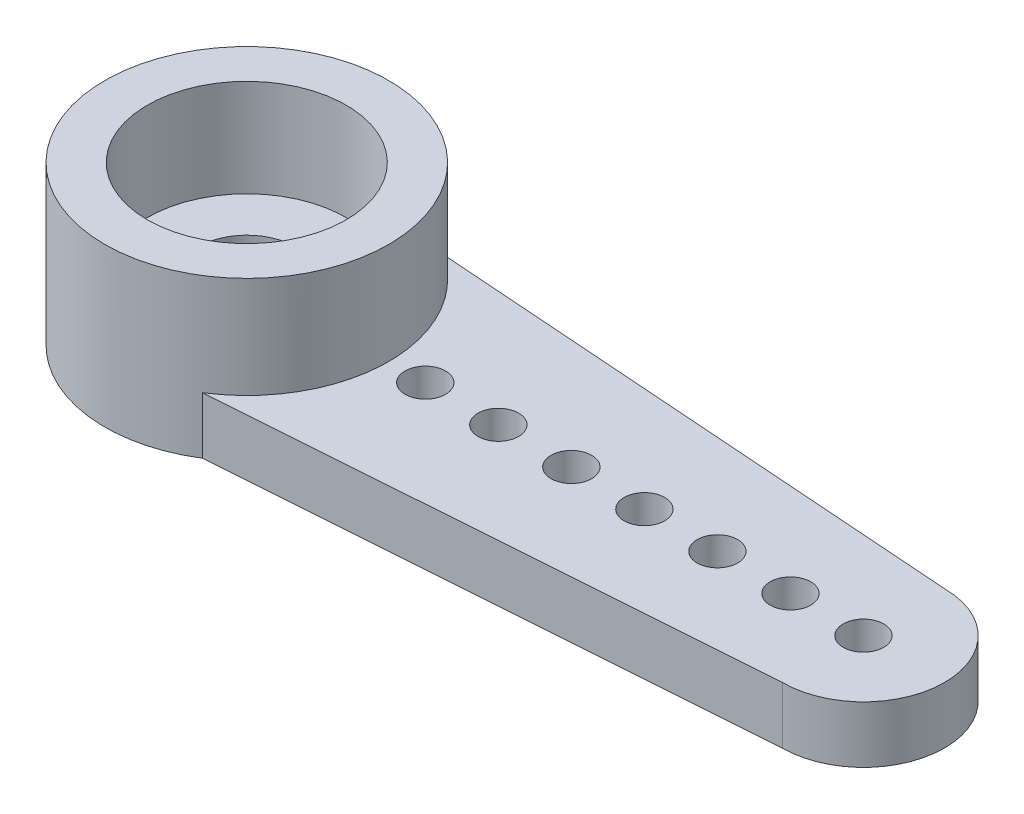
from build123d import *

# Parameters (mm, degrees)
SKETCH1_R           = 0.5
BOSS_EXTRUDE1_DEPTH = 1.4
SKETCH2_R           = 2.35
CUT_EXTRUDE1_DEPTH  = 1
SKETCH3_R           = 3.5
SKETCH3_R_2         = 2.45
BOSS_EXTRUDE2_DEPTH = 2.5
SKETCH4_R           = 1.2
CUT_EXTRUDE2_DEPTH  = 20.282440198
SKETCH5_R           = 2.45
SKETCH5_R_2         = 1.2
BOSS_EXTRUDE3_DEPTH = 0.1
SKETCH6_W           = 35.735260114
SKETCH6_H           = 17.672039004
CUT_EXTRUDE4_DEPTH  = 20.513392837
CUT_EXTRUDE6_DEPTH  = 18.729636206


with BuildPart() as part:
    # Sketch1 → Boss-Extrude1 (new body)
    with BuildSketch(Plane(origin=(0, 0, 0), x_dir=(1, 0, 0), z_dir=(0, 1, 0))):
        with BuildLine():
            Line((-15.2, 2), (-2, 2.95))
            Line((-2, 2.95), (-2, 6.35))
            ThreePointArc((-2, 6.35), (0, 8.35), (2, 6.35))
            Line((2, 6.35), (2, 3.5))
            Line((2, 3.5), (15.2, 2))
            ThreePointArc((15.2, 2), (17.2, 0), (15.2, -2))
            Line((15.2, -2), (2, -3.5))
            Line((2, -3.5), (2, -6.35))
            ThreePointArc((2, -6.35), (0, -8.35), (-2, -6.35))
            Line((-2, -6.35), (-2, -2.95))
            Line((-2, -2.95), (-15.2, -2))
            ThreePointArc((-15.2, -2), (-17.2, 0), (-15.2, 2))
        make_face()
        with Locations(Location((0, 6.35, 0), (0, 0, 270))):
            Circle(SKETCH1_R, mode=Mode.SUBTRACT)
        with Locations(Location((0, 4.55, 0), (0, 0, 270))):
            Circle(SKETCH1_R, mode=Mode.SUBTRACT)
        with Locations(Location((0, -4.55, 0), (0, 0, 90))):
            Circle(SKETCH1_R, mode=Mode.SUBTRACT)
        with Locations(Location((0, -6.35, 0), (0, 0, 90))):
            Circle(SKETCH1_R, mode=Mode.SUBTRACT)
        with Locations(Location((-15.2, 0, 0), (0, 0, 270))):
            Circle(SKETCH1_R, mode=Mode.SUBTRACT)
        with Locations(Location((15.2, 0, 0), (0, 0, 270))):
            Circle(SKETCH1_R, mode=Mode.SUBTRACT)
        with Locations(Location((-13.4, 0, 0), (0, 0, 270))):
            Circle(SKETCH1_R, mode=Mode.SUBTRACT)
        with Locations(Location((-11.6, 0, 0), (0, 0, 270))):
            Circle(SKETCH1_R, mode=Mode.SUBTRACT)
        with Locations(Location((-9.8, 0, 0), (0, 0, 270))):
            Circle(SKETCH1_R, mode=Mode.SUBTRACT)
        with Locations(Location((-8, 0, 0), (0, 0, 270))):
            Circle(SKETCH1_R, mode=Mode.SUBTRACT)
        with Locations(Location((-6.2, 0, 0), (0, 0, 270))):
            Circle(SKETCH1_R, mode=Mode.SUBTRACT)
        with Locations(Location((-4.4, 0, 0), (0, 0, 270))):
            Circle(SKETCH1_R, mode=Mode.SUBTRACT)
        with Locations(Location((13.4, 0, 0), (0, 0, 270))):
            Circle(SKETCH1_R, mode=Mode.SUBTRACT)
        with Locations(Location((11.6, 0, 0), (0, 0, 270))):
            Circle(SKETCH1_R, mode=Mode.SUBTRACT)
        with Locations(Location((9.8, 0, 0), (0, 0, 270))):
            Circle(SKETCH1_R, mode=Mode.SUBTRACT)
        with Locations(Location((8, 0, 0), (0, 0, 270))):
            Circle(SKETCH1_R, mode=Mode.SUBTRACT)
        with Locations(Location((6.2, 0, 0), (0, 0, 270))):
            Circle(SKETCH1_R, mode=Mode.SUBTRACT)
        with Locations(Location((4.4, 0, 0), (0, 0, 270))):
            Circle(SKETCH1_R, mode=Mode.SUBTRACT)
    extrude(amount=BOSS_EXTRUDE1_DEPTH)

    # Sketch2 → Cut-Extrude1 (cut)
    with BuildSketch(Plane.XZ):
        with Locations(Location((0, 0, 0), (0, 0, 270))):
            Circle(SKETCH2_R)
    extrude(amount=-CUT_EXTRUDE1_DEPTH, mode=Mode.SUBTRACT)

    # Sketch3 → Boss-Extrude2 (add)
    with BuildSketch(Plane(origin=(0, 1.4, 0), x_dir=(1, 0, 0), z_dir=(0, 1, 0))):
        with Locations(Location((0, 0, 0), (0, 0, 270))):
            Circle(SKETCH3_R)
        with Locations(Location((0, 0, 0), (0, 0, 270))):
            Circle(SKETCH3_R_2, mode=Mode.SUBTRACT)
    extrude(amount=BOSS_EXTRUDE2_DEPTH)

    # Sketch4 → Cut-Extrude2 (cut, through all)
    with BuildSketch(Plane(origin=(0, 1.4, 0), x_dir=(1, 0, 0), z_dir=(0, 1, 0))):
        with Locations(Location((0, 0, 0), (0, 0, 270))):
            Circle(SKETCH4_R)
    extrude(amount=-CUT_EXTRUDE2_DEPTH, mode=Mode.SUBTRACT)

    # Sketch5 → Boss-Extrude3 (add)
    with BuildSketch(Plane(origin=(0, 1.4, 0), x_dir=(1, 0, 0), z_dir=(0, 1, 0))):
        with Locations(Location((0, 0, 0), (0, 0, 270))):
            Circle(SKETCH5_R)
        with Locations(Location((0, 0, 0), (0, 0, 270))):
            Circle(SKETCH5_R_2, mode=Mode.SUBTRACT)
    extrude(amount=BOSS_EXTRUDE3_DEPTH)

    # Sketch6 → Cut-Extrude4 (cut, through all)
    with BuildSketch(Plane.XZ):
        Rectangle(SKETCH6_W, SKETCH6_H)
        with BuildLine():
            Line((-1.868584713, -2.959457918), (-15.2, -2))
            ThreePointArc((-15.2, -2), (-17.2, 0), (-15.2, 2))
            Line((-15.2, 2), (-1.868584713, 2.959457918))
            ThreePointArc((-1.868584713, 2.959457918), (0, 3.5), (1.868584713, 2.959457918))
            Line((1.868584713, 2.959457918), (15.2, 2))
            ThreePointArc((15.2, 2), (17.2, 0), (15.2, -2))
            Line((15.2, -2), (1.868584713, -2.959457918))
            ThreePointArc((1.868584713, -2.959457918), (0, -3.5), (-1.868584713, -2.959457918))
        make_face(mode=Mode.SUBTRACT)
    extrude(amount=-CUT_EXTRUDE4_DEPTH, mode=Mode.SUBTRACT)

    # Sketch8 → Cut-Extrude6 (cut, through all)
    with BuildSketch(Plane(origin=(0, 1.4, 0), x_dir=(1, 0, 0), z_dir=(0, 1, 0))):
        with BuildLine():
            Line((-15.2, -2), (-1.868584713, -2.959457918))
            ThreePointArc((-1.868584713, -2.959457918), (-3.5, 0), (-1.868584713, 2.959457918))
            Line((-1.868584713, 2.959457918), (-15.2, 2))
            ThreePointArc((-15.2, 2), (-17.2, 0), (-15.2, -2))
        make_face()
    extrude(amount=-CUT_EXTRUDE6_DEPTH, mode=Mode.SUBTRACT)


solid = part.part
